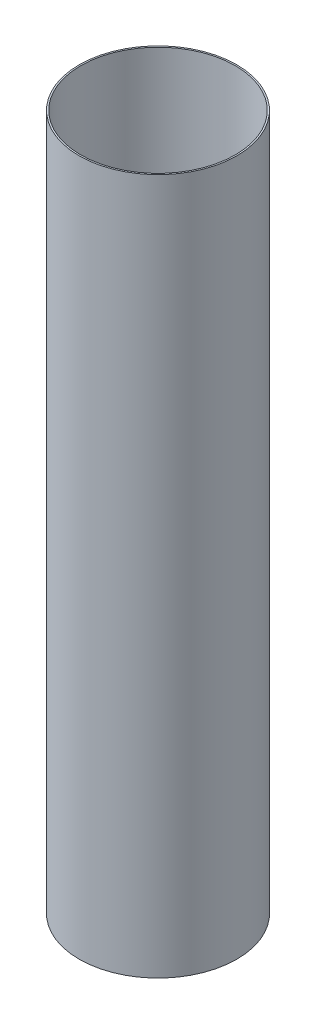
from build123d import *

# Parameters (mm, degrees)
SKETCH_1_R      = 51
SKETCH_1_R_2    = 50
EXTRUDE_1_DEPTH = 450


with BuildPart() as part:
    # Эскиз1 → Бобышка-Вытянуть1 (new body)
    with BuildSketch(Plane(origin=(0, 0, 0), x_dir=(1, 0, 0), z_dir=(0, 1, 0))):
        with Locations(Location((0, 0, 0), (0, 0, 270))):
            Circle(SKETCH_1_R)
        with Locations(Location((0, 0, 0), (0, 0, 270))):
            Circle(SKETCH_1_R_2, mode=Mode.SUBTRACT)
    extrude(amount=EXTRUDE_1_DEPTH)


solid = part.part
